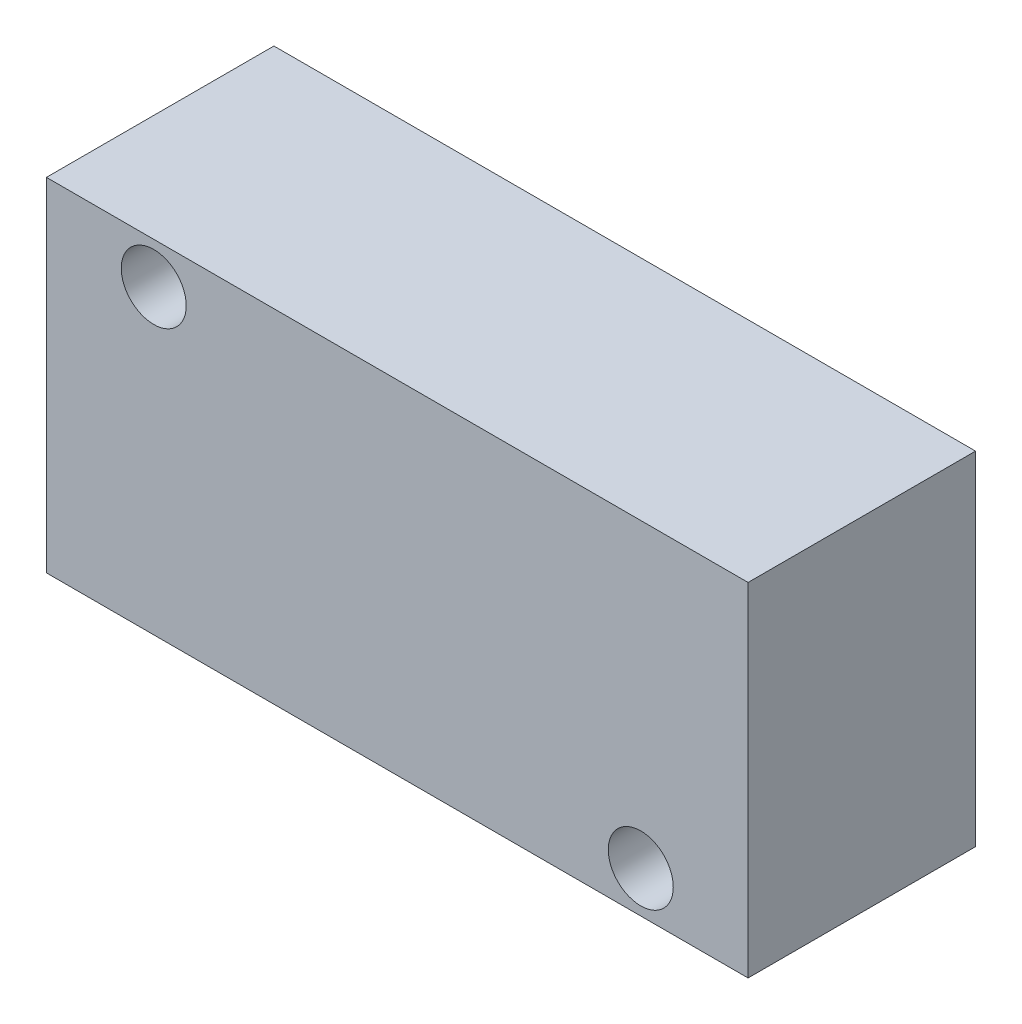
from build123d import *

# Parameters (mm, degrees)
SKIZZE1_W                       = 43.18
SKIZZE1_H                       = 21.082
AUFSATZ_LINEAR_AUSTRAGEN1_DEPTH = 14
SKIZZE2_R                       = 2
SCHNITT_LINEAR_AUSTRAGEN1_DEPTH = 28.807207357


with BuildPart() as part:
    # Skizze1 → Aufsatz-Linear austragen1 (new body)
    with BuildSketch(Plane.XY):
        Rectangle(SKIZZE1_W, SKIZZE1_H)
    extrude(amount=AUFSATZ_LINEAR_AUSTRAGEN1_DEPTH)

    # Skizze2 → Schnitt-Linear austragen1 (cut, through all)
    with BuildSketch(Plane.XY.offset(14)):
        with Locations((-14.986, 8.001)):
            Circle(SKIZZE2_R)
        with Locations((14.986, -8.001)):
            Circle(SKIZZE2_R)
    extrude(amount=-SCHNITT_LINEAR_AUSTRAGEN1_DEPTH, mode=Mode.SUBTRACT)


solid = part.part
